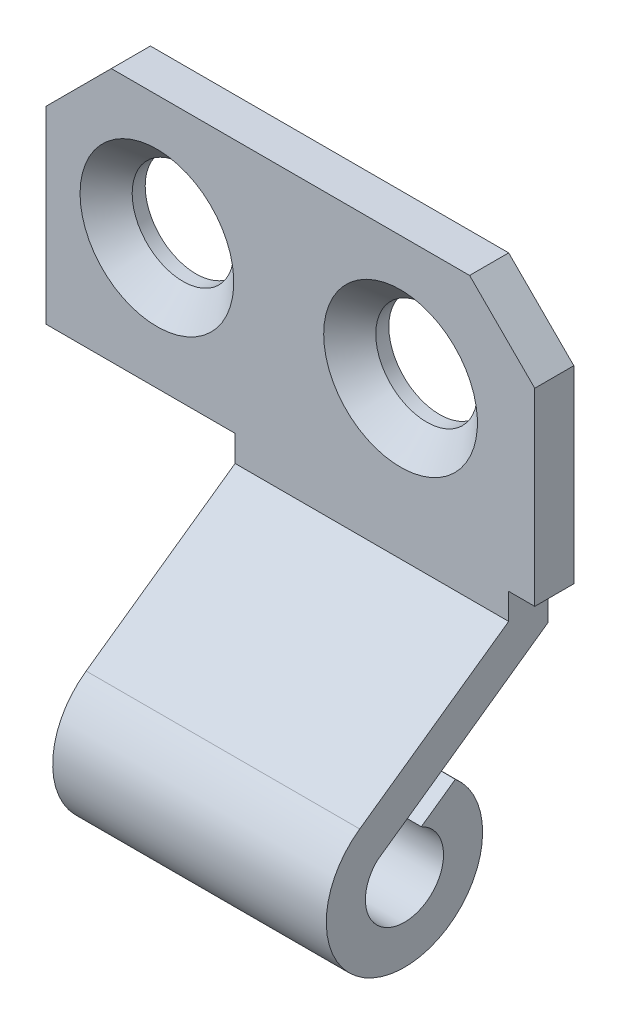
from build123d import *

# Parameters (mm, degrees)
SZKIC1_R                         = 3.9
DODANIE_WYCI_GNI_CIE1_DEPTH      = 3
SFAZOWANIE1_SIZE                 = 2
DODANIE_WYCI_GNI_CIE2_DEPTH      = 16.75
DODANIE_WYCI_GNI_CIE2_DEPTH_BACK = 4.25


with BuildPart() as part:
    # Szkic1 → Dodanie-wyciągnięcie1 (new body)
    with BuildSketch(Plane.XY):
        Polygon((-13.75, 9.75), (-18.75, 4.75), (-18.75, -9.75), (-4.25, -9.75), (-4.25, -11.75), (16.75, -11.75), (16.75, -9.75), (18.75, -9.75), (18.75, 4.75), (13.75, 9.75), align=None)
        with Locations((8.45, 0.25)):
            Circle(SZKIC1_R, mode=Mode.SUBTRACT)
        with Locations((-10.25, 0.25)):
            Circle(SZKIC1_R, mode=Mode.SUBTRACT)
    extrude(amount=DODANIE_WYCI_GNI_CIE1_DEPTH)

    # Sfazowanie1
    sfazowanie1_edges = [part.edges().sort_by_distance(p)[0] for p in [
        (4.55, 0.25, 3),
        (-14.15, 0.25, 3),
    ]]
    chamfer(sfazowanie1_edges, length=SFAZOWANIE1_SIZE)

    # Szkic2 → Dodanie-wyciągnięcie2 (add, two sides: drawn at the far end of the back side and taken through both)
    with BuildSketch(Plane(origin=(0, 0, 0), x_dir=(0, 0, -1), z_dir=(1, 0, 0)).offset(-DODANIE_WYCI_GNI_CIE2_DEPTH_BACK)):
        with BuildLine():
            Line((-3, -11.75), (-14.433393367, -19.829450235))
            ThreePointArc((-14.433393367, -19.829450235), (-11.300096726, -30.742490463), (-7.092187095, -20.19708903))
            Line((-7.092187095, -20.19708903), (-9.705385917, -22.043715762))
            ThreePointArc((-9.705385917, -22.043715762), (-10.51292291, -27.710195248), (-13.093480354, -22.601200333))
            Line((-13.093480354, -22.601200333), (0, -13.348643413))
            Line((0, -13.348643413), (0, -11.75))
            Line((0, -11.75), (-3, -11.75))
        make_face()
    extrude(amount=DODANIE_WYCI_GNI_CIE2_DEPTH + DODANIE_WYCI_GNI_CIE2_DEPTH_BACK)


solid = part.part
